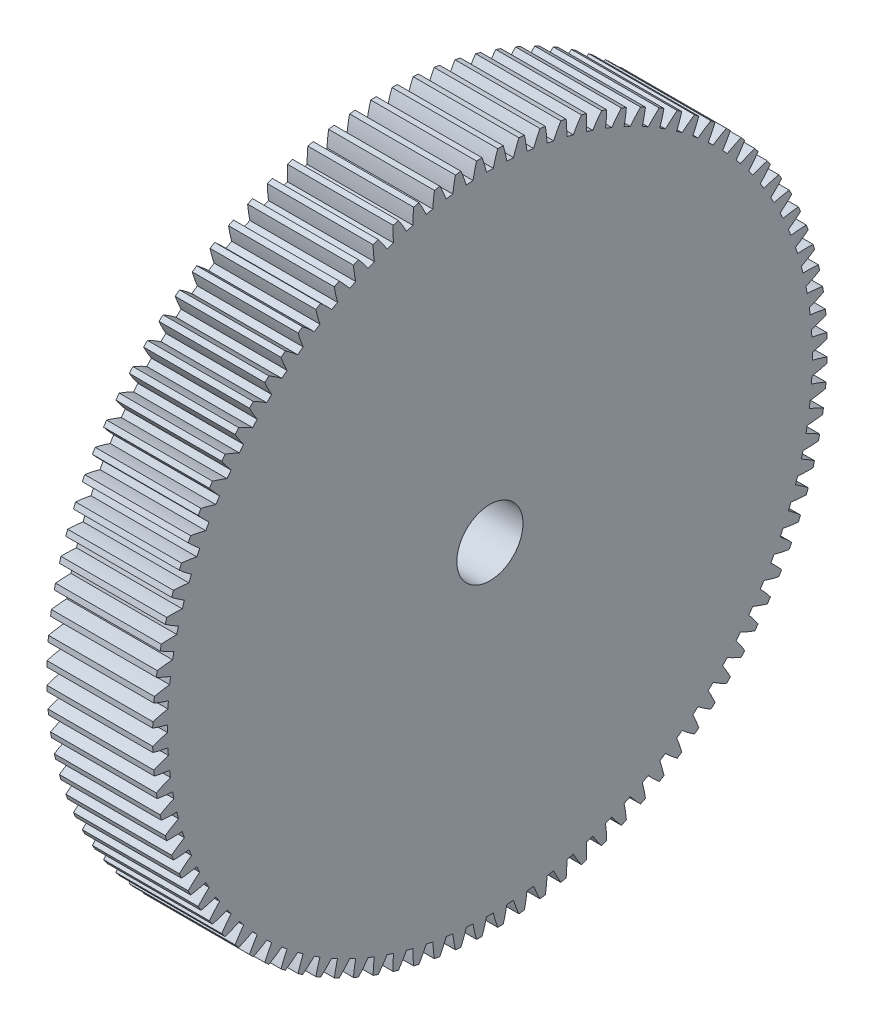
from build123d import *

# Parameters (mm, degrees)
BASPROSKE_W     = 8
BASPROSKE_H     = 25.5
TOOTHCUT_DEPTH  = 37.939139135
TEETHCUTS_COUNT = 100
TEETHCUTS_ANGLE = 356.4
BORSKE_R        = 2.5
BORE_DEPTH      = 50.0000508


with BuildPart() as part:
    # BasProSke → Base-Revolve (revolve)
    with BuildSketch(Plane(origin=(0, 0, 0), x_dir=(1, 0, 0), z_dir=(0, 1, 0)), mode=Mode.PRIVATE) as base_revolve_sk:
        with Locations((4, 12.75)):
            Rectangle(BASPROSKE_W, BASPROSKE_H)
    revolve(base_revolve_sk.sketch.rotate(Axis((-10, 0, 0), (1, 0, 0)), 180), axis=Axis((-10, 0, 0), (1, 0, 0)))

    # TooCutSke → ToothCut (cut, through all)
    with BuildSketch(Plane(origin=(0, 0, 0), x_dir=(0, 0, -1), z_dir=(1, 0, 0))):
        with BuildLine():
            ThreePointArc((0.255467444, 24.372661167), (0, 24.374), (-0.255467444, 24.372661167))
            ThreePointArc((-0.255467444, 24.372661167), (-0.411959314, 24.950673191), (-0.602767708, 25.518282))
            ThreePointArc((-0.602767708, 25.518282), (0, 25.5254), (0.602767708, 25.518282))
            ThreePointArc((0.602767708, 25.518282), (0.411959314, 24.950673191), (0.255467444, 24.372661167))
        make_face()
    toothcut = extrude(amount=TOOTHCUT_DEPTH, mode=Mode.SUBTRACT)

    # TeethCuts: ToothCut ×100 about axis
    teethcuts_axis = Axis((-10, 0, 0), (1, 0, 0))
    for i in range(1, TEETHCUTS_COUNT):
        add(toothcut.rotate(teethcuts_axis, i * TEETHCUTS_ANGLE / (TEETHCUTS_COUNT - 1)), mode=Mode.SUBTRACT)

    # BorSke → Bore (cut, symmetric)
    with BuildSketch(Plane(origin=(0, 0, 0), x_dir=(0, 0, -1), z_dir=(1, 0, 0))):
        with Locations(Location((0, 0, 0), (0, 0, 180))):
            Circle(BORSKE_R)
    extrude(amount=BORE_DEPTH, both=True, mode=Mode.SUBTRACT)


solid = part.part
